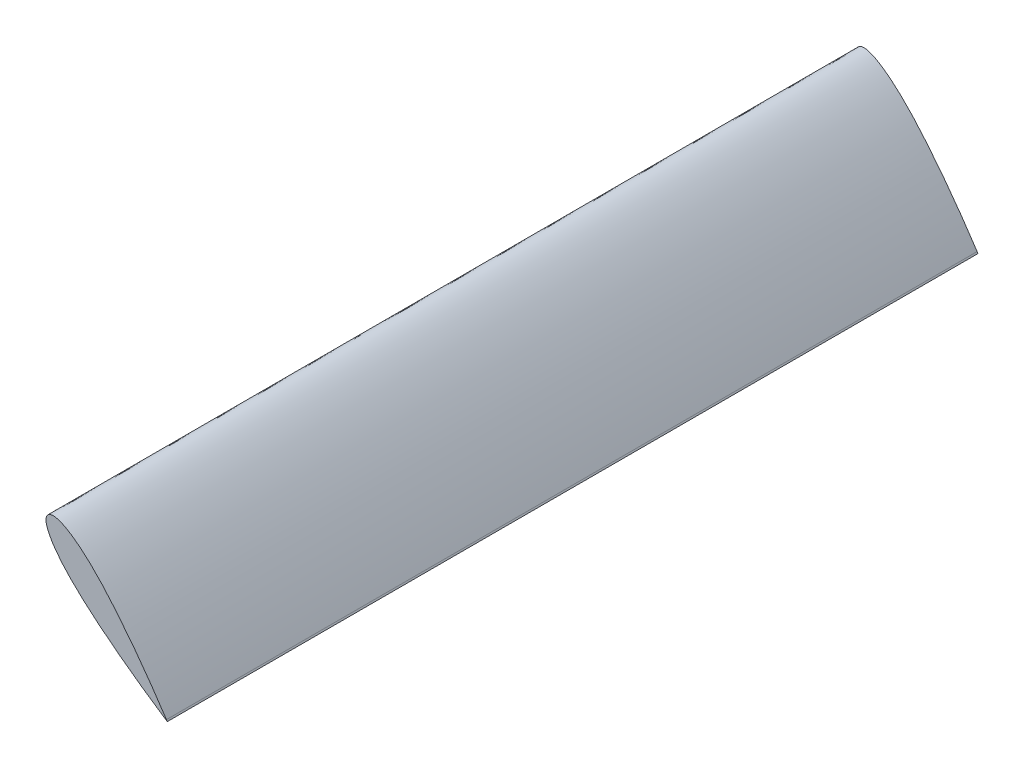
from build123d import *

# Parameters (mm, degrees)
BOSS_EXTRUDE1_DEPTH = 480
BOSS_EXTRUDE2_DEPTH = 30
LPATTERN2_COUNT     = 2
LPATTERN2_PITCH     = 343


with BuildPart() as part:
    # Sketch1 → Boss-Extrude1 (new body)
    with BuildSketch(Plane.XY):
        with BuildLine():
            Line((222.19893268, 152.769463227), (222.971969448, 152.261291338))
            Line((222.971969448, 152.261291338), (222.463797559, 153.034328106))
            add(Edge.make_bspline(
                [(222.463797559, 153.034328106), (221.537840921, 154.442903712), (219.68800994, 157.256887314), (215.914326097, 162.81939992), (211.107514123, 169.683248276), (205.19444296, 177.786001788), (199.137847408, 185.743065938), (192.908088776, 193.527158724), (186.450288409, 201.086583918), (180.798559538, 207.129616938), (176.045354548, 211.72664868), (172.328379315, 215.028028225), (168.411412384, 218.142610846), (164.924624096, 220.508144494), (161.923966548, 222.175241583), (159.468039952, 223.283870906), (157.163981456, 223.965510232), (154.668778154, 224.216709772), (151.881912824, 223.351347962), (151.016551013, 220.564482631), (151.267750554, 218.06927933), (151.94938988, 215.765220834), (153.058019203, 213.309294238), (154.725116292, 210.30863669), (157.09064994, 206.821848402), (160.205232561, 202.90488147), (163.506612106, 199.187906238), (168.103643848, 194.434701248), (174.146676868, 188.782972377), (181.706102062, 182.32517201), (189.490194848, 176.095413378), (197.447258998, 170.038817826), (205.55001251, 164.125746663), (212.413860866, 159.318934689), (217.976373471, 155.545250845), (220.790357074, 153.695419865), (222.19893268, 152.769463227)],
                knots=[0, 0, 0, 0, 0.024603844, 0.049152359, 0.098108667, 0.146905312, 0.195554797, 0.244056277, 0.292409554, 0.340643731, 0.364754111, 0.3889056, 0.413178108, 0.437756239, 0.450304697, 0.463229879, 0.477067953, 0.485035559, 0.5, 0.514964441, 0.522932047, 0.536770121, 0.549695303, 0.562243761, 0.586821892, 0.6110944, 0.635245889, 0.659356269, 0.707590446, 0.755943723, 0.804445203, 0.853094688, 0.901891333, 0.950847641, 0.975396156, 1, 1, 1, 1], degree=3))
        make_face()
    extrude(amount=BOSS_EXTRUDE1_DEPTH)

    # Sketch4 → Boss-Extrude2 (add)
    with BuildSketch(Plane(origin=(187.616630393, 187.616630393, 0), x_dir=(0, 0, 1), z_dir=(-0.7071067811865496, -0.7071067811865456, 0))):
        Polygon((389.173913044, 8.791738861), (400.544953766, -0.990869835), (395.984322843, -6.292024317), (384.608695653, 3.485253191), (382, 0.452975665), (395.217391303, -10.918065057), (405, 0.452975665), (391.782608697, 11.824016388), align=None)
    boss_extrude2 = extrude(amount=BOSS_EXTRUDE2_DEPTH)

    # LPattern2: Boss-Extrude2 ×2
    with Locations(*[(0, 0, -i * LPATTERN2_PITCH) for i in range(1, LPATTERN2_COUNT)]):
        add(boss_extrude2)


solid = part.part
